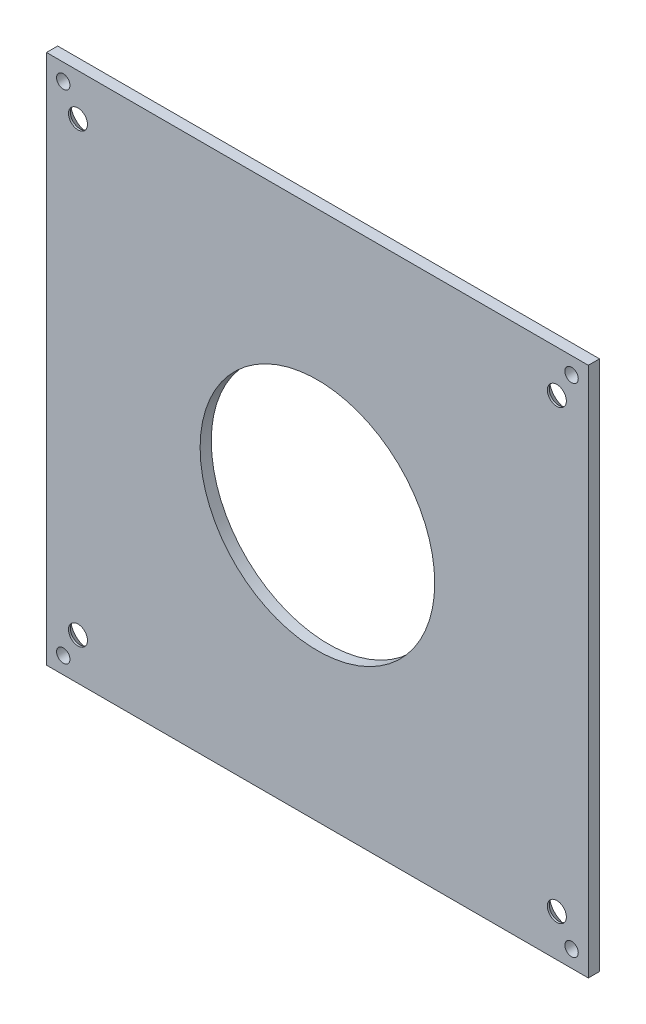
from build123d import *

# Parameters (mm, degrees)
PLATE_SKETCH_W                 = 97
PLATE_SKETCH_H                 = 95
PLATE_DEPTH                    = 2
M2_FOOT_SCREW_HOLES_DEPTH      = 136.786597277
M2_FOOT_SCREW_HOLES_DEPTH_BACK = 136.786597277
M2_FOOT_SCREW_HOLES_SKETCH_R   = 1.2
M3_STACK_ROD_HOLES_DEPTH       = 136.786597277
M3_STACK_ROD_HOLES_DEPTH_BACK  = 136.786597277
M3_STACK_ROD_HOLES_SKETCH_R    = 1.7
M3_COUNTERSINKS_SIZE           = 1.66
CAMERA_APERTURE_DEPTH          = 136.786597277
CAMERA_APERTURE_DEPTH_BACK     = 136.786597277
CAMERA_APERTURE_SKETCH_R       = 21


with BuildPart() as part:
    # Plate sketch → Plate (new body)
    with BuildSketch(Plane.XY):
        with Locations((48.5, 47.5)):
            Rectangle(PLATE_SKETCH_W, PLATE_SKETCH_H)
    extrude(amount=PLATE_DEPTH)

    # M2 foot screw holes sketch → M2 foot screw holes (cut, two sides: drawn at the far end of the back side and taken through both)
    with BuildSketch(Plane.XY.offset(-M2_FOOT_SCREW_HOLES_DEPTH_BACK)):
        with Locations((3, 3)):
            Circle(M2_FOOT_SCREW_HOLES_SKETCH_R)
        with Locations((94, 3)):
            Circle(M2_FOOT_SCREW_HOLES_SKETCH_R)
        with Locations((3, 92)):
            Circle(M2_FOOT_SCREW_HOLES_SKETCH_R)
        with Locations((94, 92)):
            Circle(M2_FOOT_SCREW_HOLES_SKETCH_R)
    extrude(amount=M2_FOOT_SCREW_HOLES_DEPTH + M2_FOOT_SCREW_HOLES_DEPTH_BACK, mode=Mode.SUBTRACT)

    # M3 stack rod holes sketch → M3 stack rod holes (cut, two sides: drawn at the far end of the back side and taken through both)
    with BuildSketch(Plane.XY.offset(-M3_STACK_ROD_HOLES_DEPTH_BACK)):
        with Locations((5.635, 7.495)):
            Circle(M3_STACK_ROD_HOLES_SKETCH_R)
        with Locations((91.365, 7.495)):
            Circle(M3_STACK_ROD_HOLES_SKETCH_R)
        with Locations((5.635, 87.505)):
            Circle(M3_STACK_ROD_HOLES_SKETCH_R)
        with Locations((91.365, 87.505)):
            Circle(M3_STACK_ROD_HOLES_SKETCH_R)
    extrude(amount=M3_STACK_ROD_HOLES_DEPTH + M3_STACK_ROD_HOLES_DEPTH_BACK, mode=Mode.SUBTRACT)

    # M3 countersinks
    m3_countersinks_edges = [part.edges().sort_by_distance(p)[0] for p in [
        (89.665, 7.495, 0),
        (3.935, 87.505, 0),
        (89.665, 87.505, 0),
        (3.935, 7.495, 0),
    ]]
    chamfer(m3_countersinks_edges, length=M3_COUNTERSINKS_SIZE)

    # Camera aperture sketch → Camera aperture (cut, two sides: drawn at the far end of the back side and taken through both)
    with BuildSketch(Plane.XY.offset(-CAMERA_APERTURE_DEPTH_BACK)):
        with Locations((48.5, 47.5)):
            Circle(CAMERA_APERTURE_SKETCH_R)
    extrude(amount=CAMERA_APERTURE_DEPTH + CAMERA_APERTURE_DEPTH_BACK, mode=Mode.SUBTRACT)


solid = part.part
